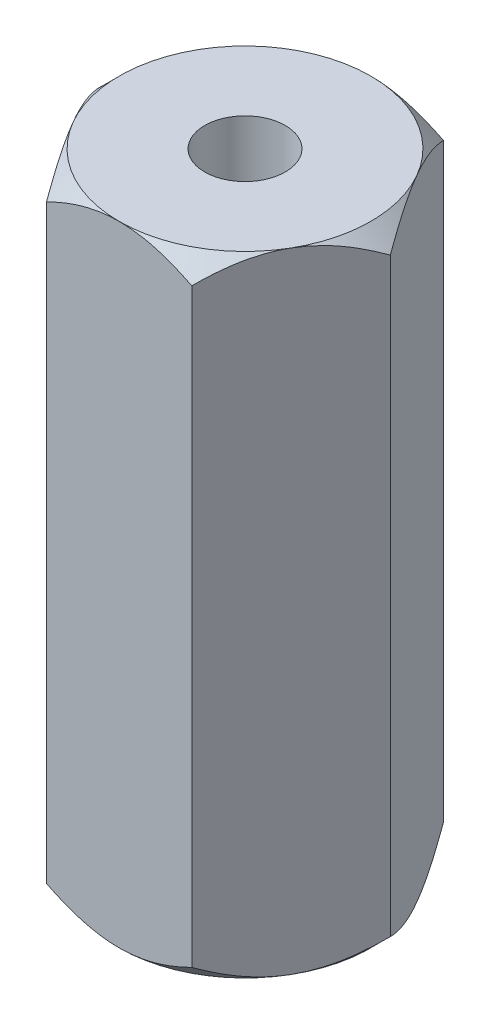
from build123d import *

# Parameters (mm, degrees)
BOSS_EXTRUDE1_DEPTH     = 8
SKETCH3_OUTSIDE_W       = 33.14
SKETCH3_OUTSIDE_H       = 32.15
SKETCH3_OUTSIDE_R       = 3.2
CUT_EXTRUDE1_DEPTH      = 10
CUT_EXTRUDE1_DRAFT      = -45
MIRROR2_COPY_1_SKETCH_W = 33.14
MIRROR2_COPY_1_SKETCH_H = 32.15
MIRROR2_COPY_1_SKETCH_R = 3.2
MIRROR2_COPY_1_DEPTH    = 10
MIRROR2_COPY_1_DRAFT    = -45


with BuildPart() as part:
    # Sketch1 → Boss-Extrude1 (new, symmetric)
    with BuildSketch(Plane(origin=(0, 0, 0), x_dir=(1, 0, 0), z_dir=(0, 1, 0))):
        Polygon((3.695041723, 0), (1.847520861, 3.2), (-1.847520861, 3.2), (-3.695041723, 0), (-1.847520861, -3.2), (1.847520861, -3.2), align=None)
    extrude(amount=BOSS_EXTRUDE1_DEPTH, both=True)


with BuildPart() as cut_extrude1_tool:
    # Sketch3 outside → Cut-Extrude1 (with draft: the straight prism first)
    with BuildSketch(Plane(origin=(0, 8, 0), x_dir=(1, 0, 0), z_dir=(0, 1, 0))):
        Rectangle(SKETCH3_OUTSIDE_W, SKETCH3_OUTSIDE_H)
        Circle(SKETCH3_OUTSIDE_R, mode=Mode.SUBTRACT)
    extrude(amount=-CUT_EXTRUDE1_DEPTH)
    # Cut-Extrude1: the draft: its side faces are tilted about the plane it starts from
    cut_extrude1_sides = [cut_extrude1_tool.faces().sort_by_distance(p)[0] for p in [
        (0, 3, 16.075),
        (16.57, 3, 0),
        (0, 3, -16.075),
        (-16.57, 3, 0),
        (-3.2, 3, 0),
    ]]
    draft(cut_extrude1_sides, Plane(origin=(0, 8, 0), x_dir=(1, 0, 0), z_dir=(0, 1, 0)), CUT_EXTRUDE1_DRAFT)


with BuildPart() as part_1:
    add(part.part)

    # Cut-Extrude1: cut by cut_extrude1_tool
    add(cut_extrude1_tool.part, mode=Mode.SUBTRACT)


with BuildPart() as mirror2_copy_1_tool:
    # Mirror2 copy 1 sketch → Mirror2 copy 1 (with draft: the straight prism first)
    with BuildSketch(Plane.XZ.offset(8)):
        Rectangle(MIRROR2_COPY_1_SKETCH_W, MIRROR2_COPY_1_SKETCH_H)
        Circle(MIRROR2_COPY_1_SKETCH_R, mode=Mode.SUBTRACT)
    extrude(amount=-MIRROR2_COPY_1_DEPTH)
    # Mirror2 copy 1: the draft: its side faces are tilted about the plane it starts from
    mirror2_copy_1_sides = [mirror2_copy_1_tool.faces().sort_by_distance(p)[0] for p in [
        (0, -3, 16.075),
        (16.57, -3, 0),
        (0, -3, -16.075),
        (-16.57, -3, 0),
        (-3.2, -3, 0),
    ]]
    draft(mirror2_copy_1_sides, Plane.XZ.offset(8), MIRROR2_COPY_1_DRAFT)


with BuildPart() as part_2:
    add(part_1.part)

    # Mirror2 copy 1: cut by mirror2_copy_1_tool
    add(mirror2_copy_1_tool.part, mode=Mode.SUBTRACT)

    # Sketch2 → M2.5 Tapped Hole1 (revolve, cut)
    with BuildSketch(Plane(origin=(0, 8, 0), x_dir=(0, 0, 1), z_dir=(1, 0, 0))):
        Polygon((0, 0), (0, 6.965882135), (1.025, 6.35), (1.025, 0), align=None)
    m2_5_tapped_hole1 = revolve(axis=Axis((0, 14.35, 0), (0, -1, 0)), mode=Mode.SUBTRACT)

    # Mirror1: M2.5 Tapped Hole1 across plane
    add(m2_5_tapped_hole1.mirror(Plane.ZX), mode=Mode.SUBTRACT)


solid = part_2.part
